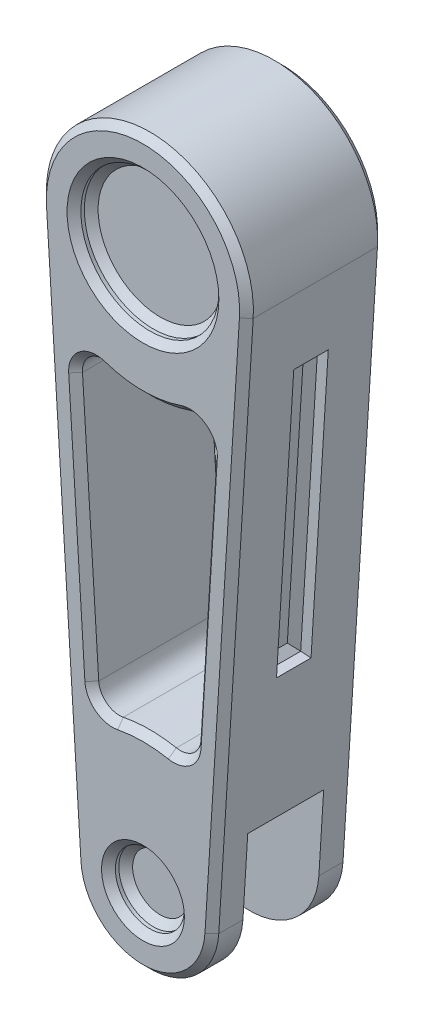
from build123d import *

# Parameters (mm, degrees)
BOSS_EXTRUDE1_DEPTH = 20
SKETCH2_R           = 26
CUT_EXTRUDE1_DEPTH  = 5
SKETCH3_R           = 30
CUT_EXTRUDE2_DEPTH  = 11
CUT_EXTRUDE3_DEPTH  = 187.815416923
FILLET1_R           = 6
CHAMFER1_SIZE       = 2
SKETCH6_W           = 10
SKETCH6_H           = 80
CUT_EXTRUDE4_DEPTH  = 5
CHAMFER2_SIZE       = 2
SKETCH7_R           = 10
SKETCH7_R_2         = 20
CUT_EXTRUDE5_DEPTH  = 5
CHAMFER3_SIZE       = 2


with BuildPart() as part:
    # Sketch1 → Boss-Extrude1 (new, symmetric)
    with BuildSketch(Plane.XY):
        with BuildLine():
            Line((-29.941348918, -1.875), (-19.960899278, -161.25))
            ThreePointArc((-19.960899278, -161.25), (0, -180), (19.960899278, -161.25))
            Line((19.960899278, -161.25), (29.941348918, -1.875))
            ThreePointArc((29.941348918, -1.875), (0, 30), (-29.941348918, -1.875))
        make_face()
    extrude(amount=BOSS_EXTRUDE1_DEPTH, both=True)

    # Sketch2 → Cut-Extrude1 (cut)
    with BuildSketch(Plane(origin=(0, 0, -20), x_dir=(-1, 0, 0), z_dir=(0, 0, -1))):
        Circle(SKETCH2_R)
    extrude(amount=-CUT_EXTRUDE1_DEPTH, mode=Mode.SUBTRACT)

    # Sketch3 → Cut-Extrude2 (cut, symmetric)
    with BuildSketch(Plane.XY):
        with Locations((0, -160)):
            Circle(SKETCH3_R)
    extrude(amount=CUT_EXTRUDE2_DEPTH, both=True, mode=Mode.SUBTRACT)

    # Sketch4 → Cut-Extrude3 (cut, through all)
    with BuildSketch(Plane(origin=(0, 0, -20), x_dir=(-1, 0, 0), z_dir=(0, 0, -1))):
        with BuildLine():
            ThreePointArc((-20.17601335, -29.814903745), (0, -36), (20.17601335, -29.814903745))
            Line((20.17601335, -29.814903745), (14.361387571, -122.667031366))
            ThreePointArc((14.361387571, -122.667031366), (0, -120), (-14.361387571, -122.667031366))
            Line((-14.361387571, -122.667031366), (-20.17601335, -29.814903745))
        make_face()
    extrude(amount=-CUT_EXTRUDE3_DEPTH, mode=Mode.SUBTRACT)

    # Fillet1
    fillet1_edges = [part.edges().sort_by_distance(p)[0] for p in [
        (20.17601335, -29.814903745, 0),
        (-20.17601335, -29.814903745, 0),
        (-14.361387571, -122.667031366, 0),
        (14.361387571, -122.667031366, 0),
    ]]
    fillet(fillet1_edges, radius=FILLET1_R)

    # Chamfer1
    chamfer1_edges = [part.edges().sort_by_distance(p)[0] for p in [
        (0, -180, 20),
        (24.951124098, -81.5625, 20),
        (0, 30, 20),
        (24.951124098, -81.5625, -20),
        (0, -120, -20),
        (0, -120, 20),
        (17.178453178, -77.682101085, -20),
        (0, -180, -20),
        (17.178453178, -77.682101085, 20),
        (-17.178453178, -77.682101085, -20),
        (-17.178453178, -77.682101085, 20),
        (-24.951124098, -81.5625, -20),
        (0, -36, -20),
        (0, -36, 20),
        (12.505327982, -119.60645162, -20),
        (12.505327982, -119.60645162, 20),
        (-12.505327982, -119.60645162, -20),
        (-12.505327982, -119.60645162, 20),
        (17.184830058, -34.989739942, -20),
        (0, 30, -20),
        (17.184830058, -34.989739942, 20),
        (-17.184830058, -34.989739942, -20),
        (-17.184830058, -34.989739942, 20),
        (-24.951124098, -81.5625, 20),
    ]]
    chamfer(chamfer1_edges, length=CHAMFER1_SIZE)

    # Sketch6 → Cut-Extrude4 (cut)
    with BuildSketch(Plane(origin=(29.941348918, -1.875, 0), x_dir=(0, 0, -1), z_dir=(0.9980449639169572, -0.06249999999999988, 0))):
        with Locations((0, -60)):
            Rectangle(SKETCH6_W, SKETCH6_H)
    extrude(amount=-CUT_EXTRUDE4_DEPTH, mode=Mode.SUBTRACT)

    # Chamfer2
    chamfer2_edges = [part.edges().sort_by_distance(p)[0] for p in [
        (21.201124098, -61.445197835, 5),
        (23.701124098, -21.523399278, 0),
        (21.201124098, -61.445197835, -5),
        (18.701124098, -101.366996392, 0),
    ]]
    chamfer(chamfer2_edges, length=CHAMFER2_SIZE)

    # Sketch7 → Cut-Extrude5 (cut)
    with BuildSketch(Plane.XY.offset(20)):
        with Locations((0, -160)):
            Circle(SKETCH7_R)
        Circle(SKETCH7_R_2)
    extrude(amount=-CUT_EXTRUDE5_DEPTH, mode=Mode.SUBTRACT)

    # Chamfer3
    chamfer3_edges = [part.edges().sort_by_distance(p)[0] for p in [
        (-10, -160, 15),
        (-10, -160, 20),
        (-20, 0, 15),
        (-20, 0, 20),
    ]]
    chamfer(chamfer3_edges, length=CHAMFER3_SIZE)


solid = part.part
